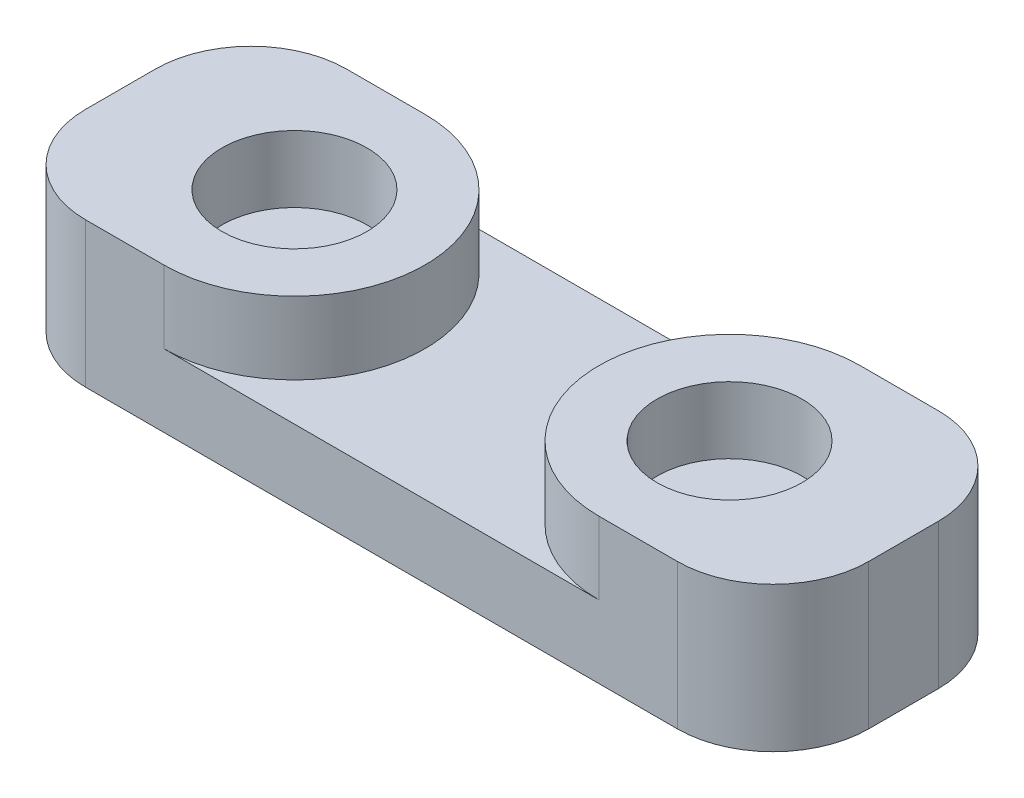
from build123d import *

# Parameters (mm, degrees)
SKETCH1_W           = 27
SKETCH1_H           = 9
BOSS_EXTRUDE1_DEPTH = 5
FILLET1_R           = 3.3
SKETCH2_R           = 2.5
CUT_EXTRUDE1_DEPTH  = 2.3
CUT_EXTRUDE4_DEPTH  = 2.5


with BuildPart() as part:
    # Sketch1 → Boss-Extrude1 (new body)
    with BuildSketch(Plane(origin=(0, 0, 0), x_dir=(1, 0, 0), z_dir=(0, 1, 0))):
        Rectangle(SKETCH1_W, SKETCH1_H)
    extrude(amount=BOSS_EXTRUDE1_DEPTH)

    # Fillet1
    fillet1_edges = [part.edges().sort_by_distance(p)[0] for p in [
        (13.5, 2.5, 4.5),
        (-13.5, 2.5, 4.5),
        (-13.5, 2.5, -4.5),
        (13.5, 2.5, -4.5),
    ]]
    fillet(fillet1_edges, radius=FILLET1_R)

    # Sketch2 → Cut-Extrude1 (cut)
    with BuildSketch(Plane(origin=(0, 5, 0), x_dir=(1, 0, 0), z_dir=(0, 1, 0))):
        with Locations(Location((-7.5, 0, 0), (0, 0, 270))):
            Circle(SKETCH2_R)
        with Locations(Location((7.5, 0, 0), (0, 0, 270))):
            Circle(SKETCH2_R)
    extrude(amount=-CUT_EXTRUDE1_DEPTH, mode=Mode.SUBTRACT)

    # Sketch4 → Cut-Extrude4 (cut)
    with BuildSketch(Plane(origin=(0, 5, 0), x_dir=(1, 0, 0), z_dir=(0, 1, 0))):
        with BuildLine():
            ThreePointArc((-3, 0), (-4.318019485, -3.181980515), (-7.5, -4.5))
            Line((-7.5, -4.5), (7.499999999, -4.5))
            ThreePointArc((7.499999999, -4.5), (3, 0), (7.5, 4.5))
            Line((7.5, 4.5), (-7.5, 4.5))
            ThreePointArc((-7.5, 4.5), (-4.318019485, 3.181980515), (-3, 0))
        make_face()
    extrude(amount=-CUT_EXTRUDE4_DEPTH, mode=Mode.SUBTRACT)


solid = part.part
